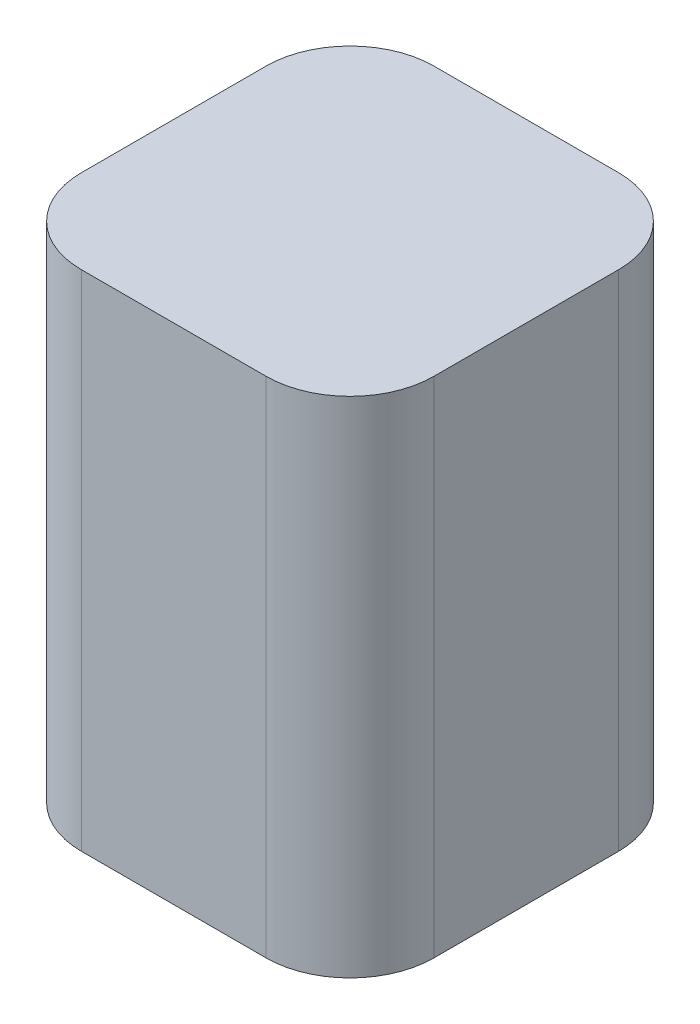
from build123d import *

# Parameters (mm, degrees)
SKETCH1_W           = 42
SKETCH1_H           = 42
BOSS_EXTRUDE1_DEPTH = 60
FILLET1_R           = 10


with BuildPart() as part:
    # Sketch1 → Boss-Extrude1 (new body)
    with BuildSketch(Plane(origin=(0, 0, 0), x_dir=(1, 0, 0), z_dir=(0, 1, 0))):
        Rectangle(SKETCH1_W, SKETCH1_H)
    extrude(amount=BOSS_EXTRUDE1_DEPTH)

    # Fillet1
    fillet1_edges = [part.edges().sort_by_distance(p)[0] for p in [
        (21, 30, 21),
        (-21, 30, 21),
        (-21, 30, -21),
        (21, 30, -21),
    ]]
    fillet(fillet1_edges, radius=FILLET1_R)


solid = part.part
